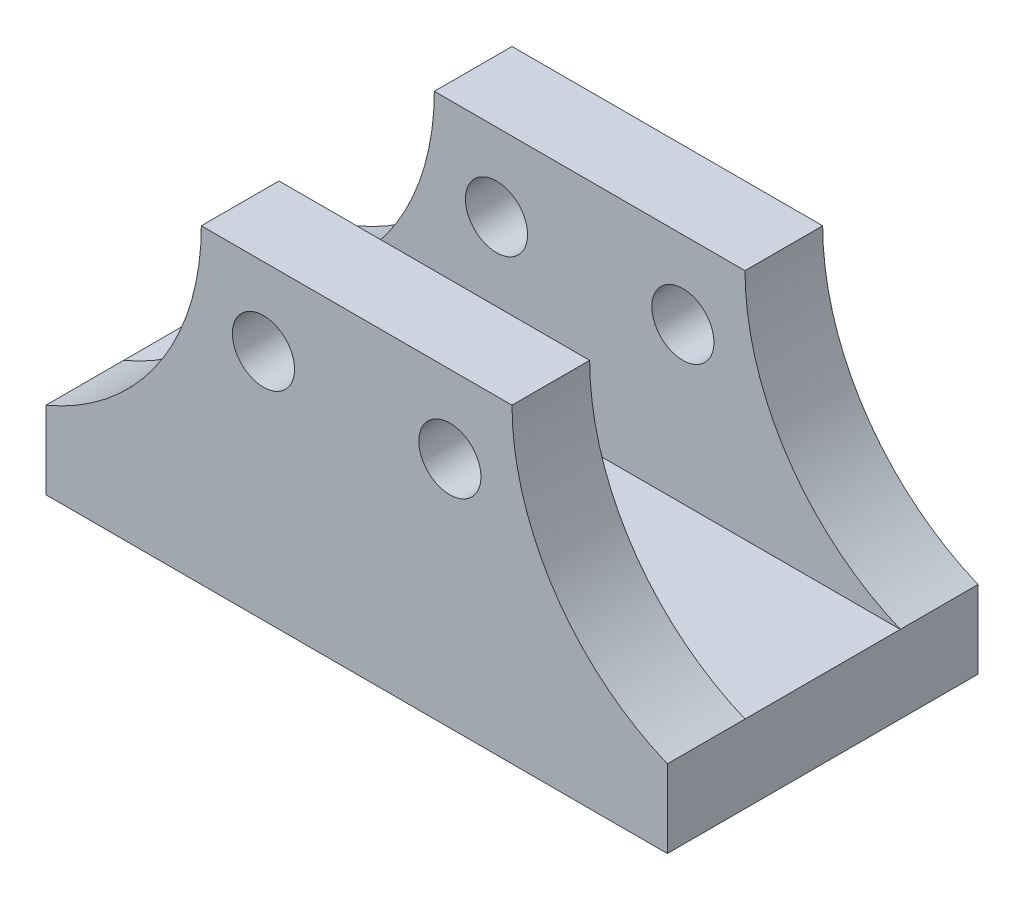
from build123d import *

# Parameters (mm, degrees)
SKETCH1_W                = 400
SKETCH1_H                = 200
BOSS_EXTRUDE1_DEPTH      = 50
BOSS_EXTRUDE2_DEPTH      = 100
BOSS_EXTRUDE2_DEPTH_BACK = 100
CUT_EXTRUDE1_DEPTH       = 200
CUT_EXTRUDE1_DEPTH_BACK  = 200
SKETCH3_W                = 100
SKETCH3_H                = 185.844044806
CUT_EXTRUDE2_DEPTH       = 200
CUT_EXTRUDE2_DEPTH_BACK  = 200
SKETCH4_R                = 20


with BuildPart() as part:
    # Sketch1 → Boss-Extrude1 (new body)
    with BuildSketch(Plane(origin=(0, 0, 0), x_dir=(1, 0, 0), z_dir=(0, 1, 0))):
        Rectangle(SKETCH1_W, SKETCH1_H)
    extrude(amount=BOSS_EXTRUDE1_DEPTH)

    # Sketch2 → Boss-Extrude2 (add, two sides: drawn at the far end of the back side and taken through both)
    with BuildSketch(Plane.XY.offset(-BOSS_EXTRUDE2_DEPTH_BACK)):
        with BuildLine():
            Line((-100, 50), (100, 50))
            Line((100, 50), (200, 50))
            ThreePointArc((200, 50), (127.29182717, 109.861218113), (100, 200))
            Line((100, 200), (-100, 200))
            ThreePointArc((-100, 200), (-127.29182717, 109.861218113), (-200, 50))
            Line((-200, 50), (-100, 50))
        make_face()
    extrude(amount=BOSS_EXTRUDE2_DEPTH + BOSS_EXTRUDE2_DEPTH_BACK)

    # Sketch3 → Cut-Extrude1 (cut, two sides: drawn at the far end of the back side and taken through both)
    with BuildSketch(Plane(origin=(0, 0, 0), x_dir=(0, 0, -1), z_dir=(1, 0, 0)).offset(-CUT_EXTRUDE1_DEPTH_BACK)):
        with Locations((0, 142.922022403)):
            Rectangle(SKETCH3_W, SKETCH3_H)
    extrude(amount=CUT_EXTRUDE1_DEPTH + CUT_EXTRUDE1_DEPTH_BACK, mode=Mode.SUBTRACT)

    # Sketch4 → Cut-Extrude2 (cut, two sides: drawn at the far end of the back side and taken through both)
    with BuildSketch(Plane.XY.offset(-CUT_EXTRUDE2_DEPTH_BACK)):
        with Locations(Location((-60, 150, 0), (0, 0, 270))):
            Circle(SKETCH4_R)
        with Locations(Location((60, 150, 0), (0, 0, 270))):
            Circle(SKETCH4_R)
    extrude(amount=CUT_EXTRUDE2_DEPTH + CUT_EXTRUDE2_DEPTH_BACK, mode=Mode.SUBTRACT)


solid = part.part
